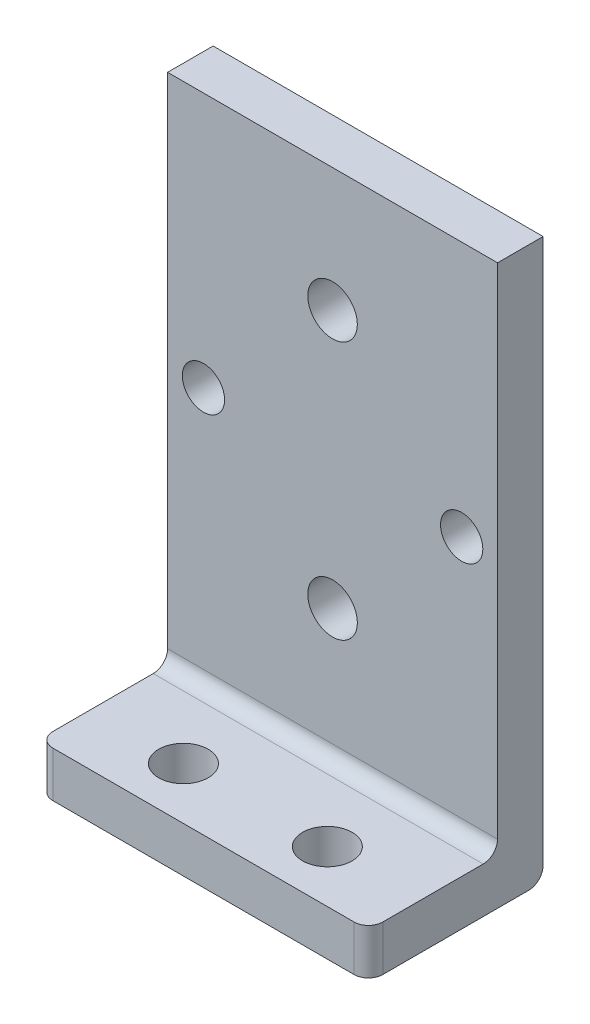
from build123d import *

# Parameters (mm, degrees)
SKETCH1_W             = 23
SKETCH1_H             = 38.970207686
SKETCH1_R             = 1.7272
SKETCH1_R_2           = 1.4732
BOSS_EXTRUDE1_DEPTH   = 3.175
BOSS_EXTRUDE2_START   = 3.175
SKETCH1_3_W           = 23
SKETCH1_3_H           = 3.175
BOSS_EXTRUDE2_DEPTH   = 9
F_8_32_TAPPED_HOLE1_D = 3.4544
FILLET1_R             = 1


with BuildPart() as part:
    # Sketch1 → Boss-Extrude1 (new body)
    with BuildSketch(Plane.XY):
        with Locations((11.5, -3.689896157)):
            Rectangle(SKETCH1_W, SKETCH1_H)
        with Locations((11.5, -10.81790431)):
            Circle(SKETCH1_R, mode=Mode.SUBTRACT)
        with Locations((2.5, -2)):
            Circle(SKETCH1_R_2, mode=Mode.SUBTRACT)
        with Locations((20.5, -2)):
            Circle(SKETCH1_R_2, mode=Mode.SUBTRACT)
        with Locations((11.5, 7.18209569)):
            Circle(SKETCH1_R, mode=Mode.SUBTRACT)
    extrude(amount=BOSS_EXTRUDE1_DEPTH)

    # Sketch1<3> → Boss-Extrude2 (add)
    with BuildSketch(Plane.XY.offset(BOSS_EXTRUDE2_START)):
        with Locations((11.5, -21.5875)):
            Rectangle(SKETCH1_3_W, SKETCH1_3_H)
    extrude(amount=BOSS_EXTRUDE2_DEPTH)

    # #8-32 Tapped Hole1 (through all)
    with Locations(Plane(origin=(6.4835, -20, 8.5555), x_dir=(1, 0, 0), z_dir=(0, 1, 0))):
        with Locations((0, 0), (10.033, 0)):
            Hole(F_8_32_TAPPED_HOLE1_D / 2)

    # Fillet1
    fillet1_edges = [part.edges().sort_by_distance(p)[0] for p in [
        (11.5, -23.175, 0),
        (0, -21.5875, 12.175),
        (11.5, -20, 3.175),
        (23, -21.5875, 12.175),
    ]]
    fillet(fillet1_edges, radius=FILLET1_R)


solid = part.part
